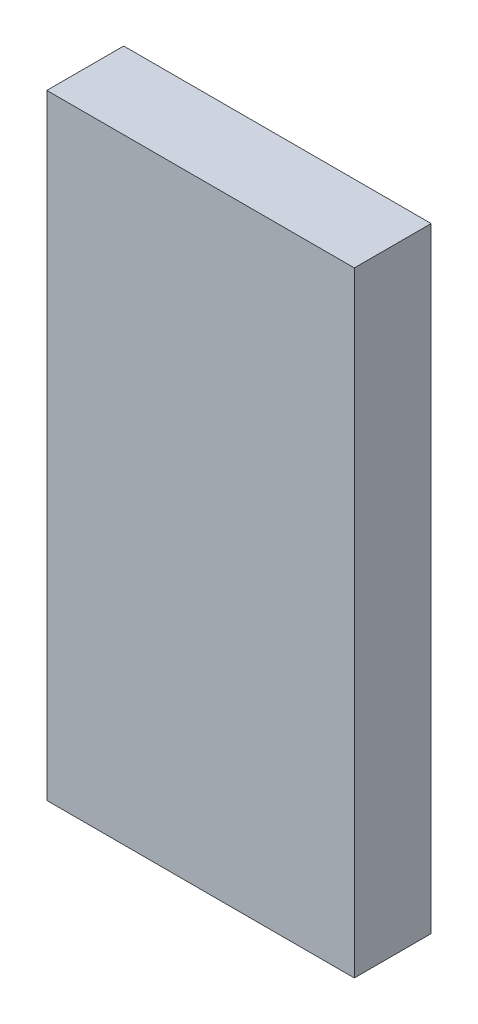
from build123d import *

# Parameters (mm, degrees)
SKETCH1_W           = 6.35
SKETCH1_H           = 12.7
BOSS_EXTRUDE1_DEPTH = 1.5875


with BuildPart() as part:
    # Sketch1 → Boss-Extrude1 (new body)
    with BuildSketch(Plane.XY):
        Rectangle(SKETCH1_W, SKETCH1_H)
    extrude(amount=BOSS_EXTRUDE1_DEPTH)


solid = part.part
